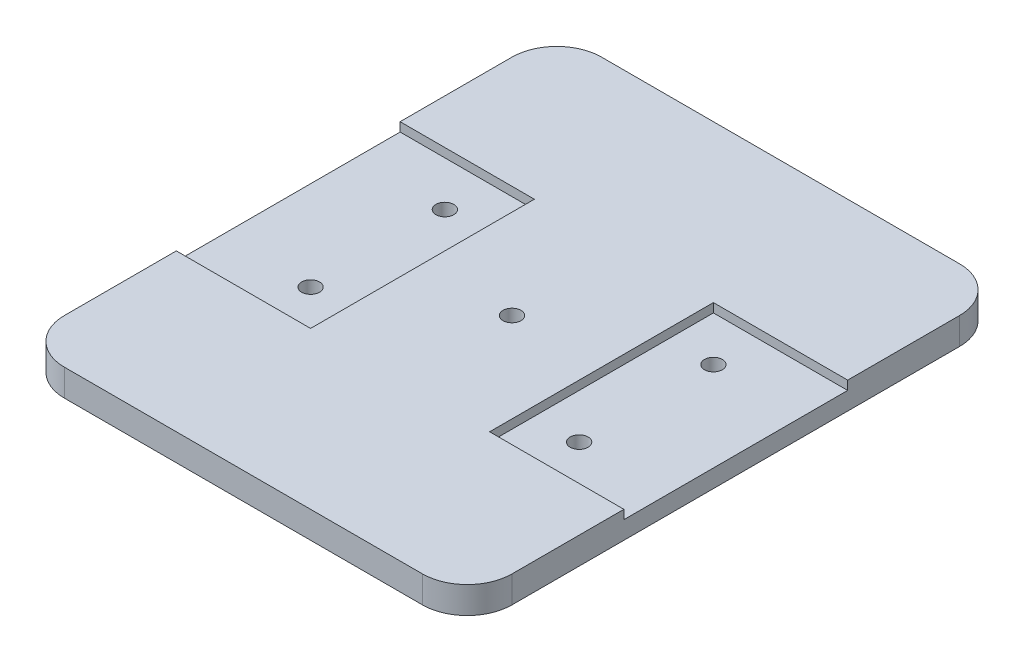
from build123d import *

# Parameters (mm, degrees)
SKETCH1_R           = 1
BOSS_EXTRUDE1_DEPTH = 3
SKETCH2_W           = 15
SKETCH2_H           = 25
CUT_EXTRUDE1_DEPTH  = 1
SKETCH3_W           = 15
SKETCH3_H           = 25
CUT_EXTRUDE2_DEPTH  = 1


with BuildPart() as part:
    # Sketch1 → Boss-Extrude1 (new body)
    with BuildSketch(Plane(origin=(0, 0, 0), x_dir=(1, 0, 0), z_dir=(0, 1, 0))):
        with BuildLine():
            Line((-52.254901961, 26.274509804), (-12.254901961, 26.274509804))
            ThreePointArc((-12.254901961, 26.274509804), (-8.719368055, 24.81004371), (-7.254901961, 21.274509804))
            Line((-7.254901961, 21.274509804), (-7.254901961, -28.725490196))
            ThreePointArc((-7.254901961, -28.725490196), (-8.719368055, -32.261024102), (-12.254901961, -33.725490196))
            Line((-12.254901961, -33.725490196), (-52.254901961, -33.725490196))
            ThreePointArc((-52.254901961, -33.725490196), (-55.790435867, -32.261024102), (-57.254901961, -28.725490196))
            Line((-57.254901961, -28.725490196), (-57.254901961, 21.274509804))
            ThreePointArc((-57.254901961, 21.274509804), (-55.790435867, 24.81004371), (-52.254901961, 26.274509804))
        make_face()
        with Locations(Location((-32.254901961, -3.725490196, 0), (0, 0, 270))):
            Circle(SKETCH1_R, mode=Mode.SUBTRACT)
        with Locations(Location((-47.254901961, 3.774509804, 0), (0, 0, 270))):
            Circle(SKETCH1_R, mode=Mode.SUBTRACT)
        with Locations(Location((-47.254901961, -11.225490196, 0), (0, 0, 270))):
            Circle(SKETCH1_R, mode=Mode.SUBTRACT)
        with Locations(Location((-17.254901961, 3.774509804, 0), (0, 0, 270))):
            Circle(SKETCH1_R, mode=Mode.SUBTRACT)
        with Locations(Location((-17.254901961, -11.225490196, 0), (0, 0, 270))):
            Circle(SKETCH1_R, mode=Mode.SUBTRACT)
    extrude(amount=BOSS_EXTRUDE1_DEPTH)

    # Sketch2 → Cut-Extrude1 (cut)
    with BuildSketch(Plane(origin=(0, 3, 0), x_dir=(1, 0, 0), z_dir=(0, 1, 0))):
        with Locations((-49.754901961, -3.725490196)):
            Rectangle(SKETCH2_W, SKETCH2_H)
    extrude(amount=-CUT_EXTRUDE1_DEPTH, mode=Mode.SUBTRACT)

    # Sketch3 → Cut-Extrude2 (cut)
    with BuildSketch(Plane(origin=(0, 3, 0), x_dir=(1, 0, 0), z_dir=(0, 1, 0))):
        with Locations((-14.754901961, -3.725490196)):
            Rectangle(SKETCH3_W, SKETCH3_H)
    extrude(amount=-CUT_EXTRUDE2_DEPTH, mode=Mode.SUBTRACT)


solid = part.part
